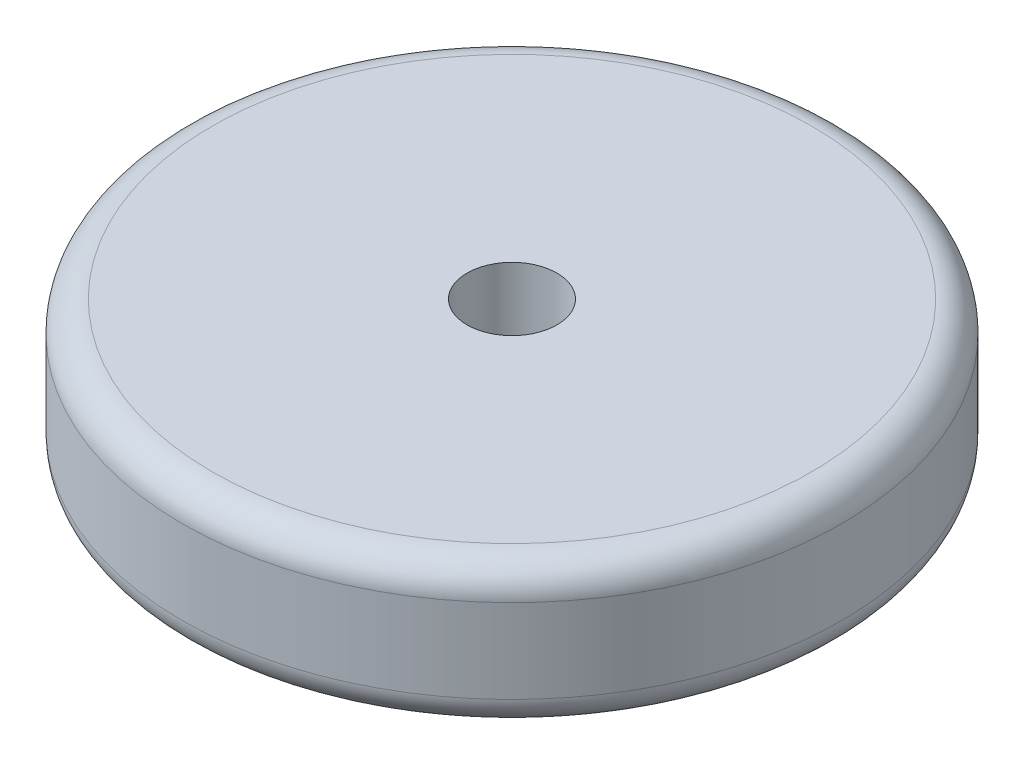
from build123d import *

# Parameters (mm, degrees)
SKETCH1_R           = 69.85
BOSS_EXTRUDE1_DEPTH = 15.24
SKETCH2_R           = 9.525
CUT_EXTRUDE1_DEPTH  = 30.48
FILLET1_R           = 6.35


with BuildPart() as part:
    # Sketch1 → Boss-Extrude1 (new, symmetric)
    with BuildSketch(Plane(origin=(0, 0, 0), x_dir=(1, 0, 0), z_dir=(0, 1, 0))):
        with Locations(Location((0, 0, 0), (0, 0, 90))):
            Circle(SKETCH1_R)
    extrude(amount=BOSS_EXTRUDE1_DEPTH, both=True)

    # Sketch2 → Cut-Extrude1 (cut)
    with BuildSketch(Plane(origin=(0, 15.24, 0), x_dir=(1, 0, 0), z_dir=(0, 1, 0))):
        with Locations(Location((0, 0, 0), (0, 0, 270))):
            Circle(SKETCH2_R)
    extrude(amount=-CUT_EXTRUDE1_DEPTH, mode=Mode.SUBTRACT)

    # Fillet1
    fillet1_edges = [part.edges().sort_by_distance(p)[0] for p in [
        (0, -15.24, 69.85),
        (0, 15.24, 69.85),
    ]]
    fillet(fillet1_edges, radius=FILLET1_R)


solid = part.part
